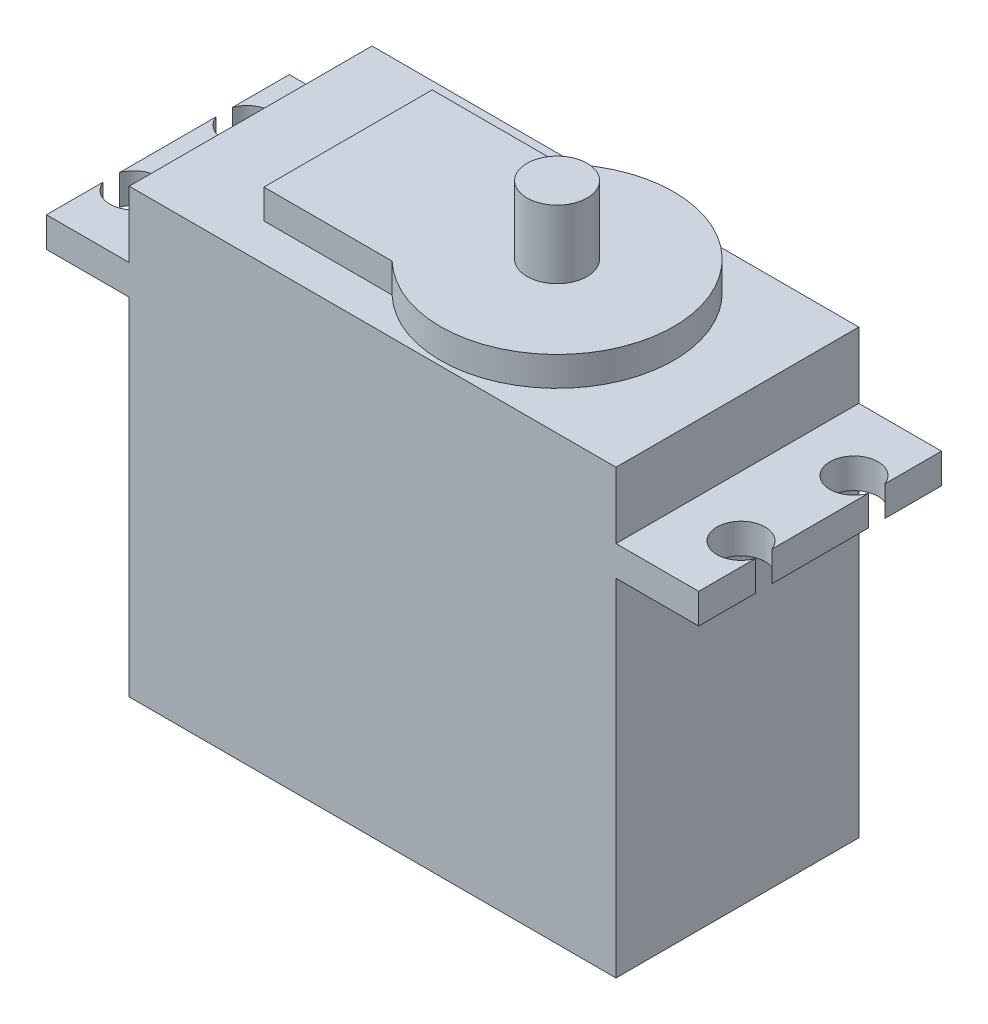
from build123d import *

# Parameters (mm, degrees)
CROQUIS1_W              = 40.5
CROQUIS1_H              = 20.2
SALIENTE_EXTRUIR1_DEPTH = 36.8
CROQUIS2_R              = 9.710333118
SALIENTE_EXTRUIR2_DEPTH = 2.44
CROQUIS3_R              = 2.5
SALIENTE_EXTRUIR3_DEPTH = 5.66
CROQUIS4_W              = 20.2
CROQUIS4_H              = 2.5
SALIENTE_EXTRUIR4_DEPTH = 6.88
CROQUIS5_W              = 20.2
CROQUIS5_H              = 2.5
SALIENTE_EXTRUIR5_DEPTH = 6.88
CORTAR_EXTRUIR1_DEPTH   = 61.271007956


with BuildPart() as part:
    # Croquis1 → Saliente-Extruir1 (new body)
    with BuildSketch(Plane(origin=(0, 0, 0), x_dir=(1, 0, 0), z_dir=(0, 1, 0))):
        with Locations((20.25, 10.1)):
            Rectangle(CROQUIS1_W, CROQUIS1_H)
    extrude(amount=SALIENTE_EXTRUIR1_DEPTH)

    # Croquis2 → Saliente-Extruir2 (add)
    with BuildSketch(Plane(origin=(0, 36.8, 0), x_dir=(1, 0, 0), z_dir=(0, 1, 0))):
        with Locations((25.5, 10.1)):
            Circle(CROQUIS2_R)
        with BuildLine():
            Line((18.770173162, 17.1), (8.106469176, 17.1))
            Line((8.106469176, 17.1), (8.106469176, 3.1))
            Line((8.106469176, 3.1), (18.770173162, 3.1))
            ThreePointArc((18.770173162, 3.1), (15.789666882, 10.1), (18.770173162, 17.1))
        make_face()
    extrude(amount=SALIENTE_EXTRUIR2_DEPTH)

    # Croquis3 → Saliente-Extruir3 (add)
    with BuildSketch(Plane(origin=(0, 39.24, 0), x_dir=(1, 0, 0), z_dir=(0, 1, 0))):
        with Locations(Location((25.5, 10.1, 0), (0, 0, 270))):
            Circle(CROQUIS3_R)
    extrude(amount=SALIENTE_EXTRUIR3_DEPTH)

    # Croquis4 → Saliente-Extruir4 (add)
    with BuildSketch(Plane.ZY):
        with Locations((-10.1, 30.05)):
            Rectangle(CROQUIS4_W, CROQUIS4_H)
    extrude(amount=SALIENTE_EXTRUIR4_DEPTH)

    # Croquis5 → Saliente-Extruir5 (add)
    with BuildSketch(Plane(origin=(40.5, 0, 0), x_dir=(0, 0, -1), z_dir=(1, 0, 0))):
        with Locations((10.1, 30.05)):
            Rectangle(CROQUIS5_W, CROQUIS5_H)
    extrude(amount=SALIENTE_EXTRUIR5_DEPTH)

    # Croquis6 → Cortar-Extruir1 (cut, through all)
    with BuildSketch(Plane(origin=(0, 31.3, 0), x_dir=(1, 0, 0), z_dir=(0, 1, 0))):
        with BuildLine():
            ThreePointArc((-6.88, 4.717651116), (-3, 5.4), (-6.88, 6.082348884))
            Line((-6.88, 6.082348884), (-6.88, 4.717651116))
        make_face()
        with BuildLine():
            ThreePointArc((-6.88, 14.117651116), (-3, 14.8), (-6.88, 15.482348884))
            Line((-6.88, 15.482348884), (-6.88, 14.117651116))
        make_face()
        with BuildLine():
            Line((47.38, 14.117651116), (47.38, 15.482348884))
            ThreePointArc((47.38, 15.482348884), (43.5, 14.8), (47.38, 14.117651116))
        make_face()
        with BuildLine():
            Line((47.38, 4.717651116), (47.38, 6.082348884))
            ThreePointArc((47.38, 6.082348884), (43.5, 5.4), (47.38, 4.717651116))
        make_face()
    extrude(amount=-CORTAR_EXTRUIR1_DEPTH, mode=Mode.SUBTRACT)


solid = part.part
